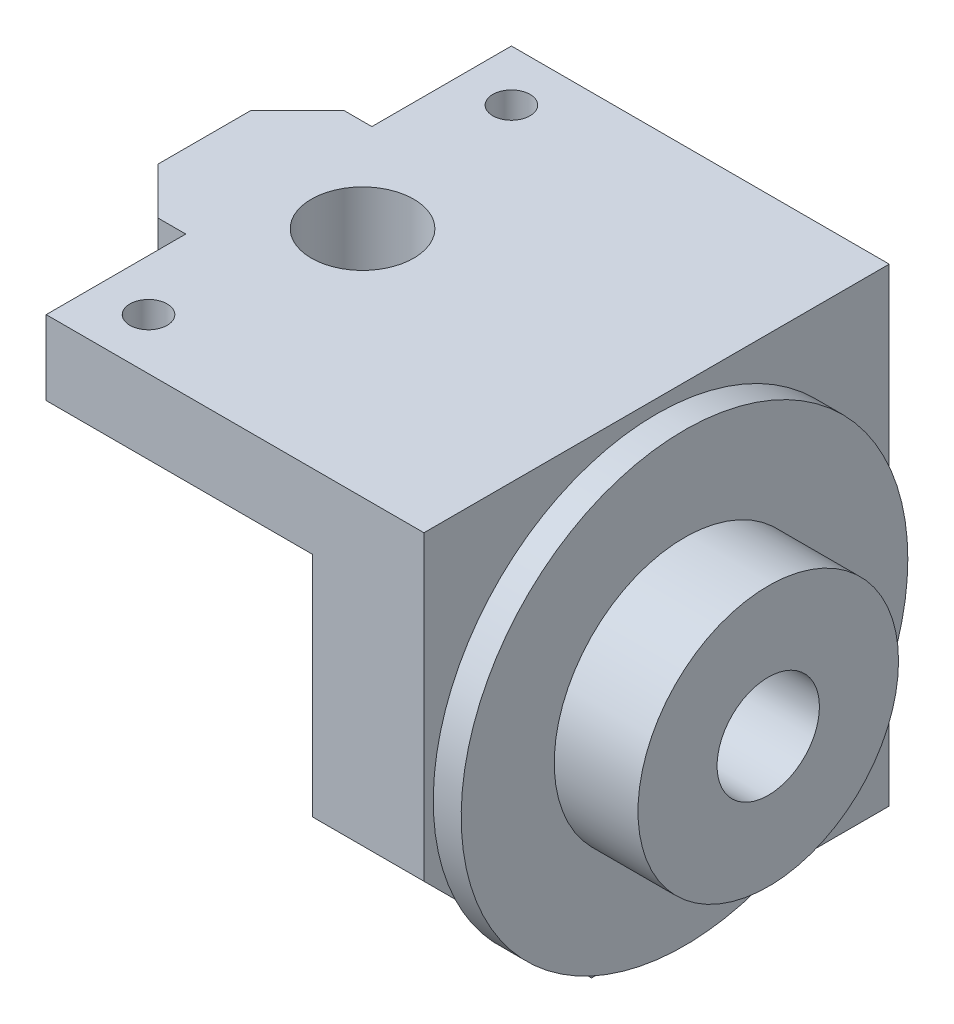
from build123d import *

# Parameters (mm, degrees)
ESQUISSE1_W             = 40.6
ESQUISSE1_H             = 50
BOSS_EXTRU_1_DEPTH      = 8
ESQUISSE2_W             = 12
ESQUISSE2_H             = 50
BOSS_EXTRU_2_DEPTH      = 42.44
CHANFREIN1_SIZE         = 18
ESQUISSE3_R             = 24
BOSS_EXTRU_3_DEPTH      = 3
ESQUISSE4_R             = 14
BOSS_EXTRU_4_DEPTH      = 9
ESQUISSE5_W             = 20
ESQUISSE5_H             = 8
BOSS_EXTRU_5_DEPTH      = 8
CHANFREIN2_SIZE         = 5
CHANFREIN3_SIZE         = 5
ESQUISSE6_R             = 5.5
ENL_V_MAT_EXTRU_1_DEPTH = 81.244733381
ESQUISSE7_R             = 5.5
ENL_V_MAT_EXTRU_2_DEPTH = 80.655939168
ESQUISSE8_R             = 2
ENL_V_MAT_EXTRU_3_DEPTH = 81.244733381


with BuildPart() as part:
    # Esquisse1 → Boss.-Extru.1 (new body)
    with BuildSketch(Plane(origin=(0, 0, 0), x_dir=(1, 0, 0), z_dir=(0, 1, 0))):
        with Locations((-26.686076334, 4.522111117)):
            Rectangle(ESQUISSE1_W, ESQUISSE1_H)
    extrude(amount=BOSS_EXTRU_1_DEPTH)

    # Esquisse2 → Boss.-Extru.2 (add)
    with BuildSketch(Plane(origin=(0, 0, 0), x_dir=(-1, 0, 0), z_dir=(0, -1, 0))):
        with Locations((12.386076334, 4.522111117)):
            Rectangle(ESQUISSE2_W, ESQUISSE2_H)
    extrude(amount=BOSS_EXTRU_2_DEPTH)

    # Chanfrein1
    chanfrein1_edges = [part.edges().sort_by_distance(p)[0] for p in [
        (-12.386076334, -42.44, 20.477888883),
    ]]
    chamfer(chanfrein1_edges, length=CHANFREIN1_SIZE)

    # Esquisse3 → Boss.-Extru.3 (add)
    with BuildSketch(Plane(origin=(-6.386076334, 0, 0), x_dir=(0, 0, -1), z_dir=(1, 0, 0))):
        with Locations(Location((4.522111117, -17.44, 0), (0, 0, 205.528779366))):
            Circle(ESQUISSE3_R)
    extrude(amount=BOSS_EXTRU_3_DEPTH)

    # Esquisse4 → Boss.-Extru.4 (add)
    with BuildSketch(Plane(origin=(-3.386076334, 0, 0), x_dir=(0, 0, -1), z_dir=(1, 0, 0))):
        with Locations((4.522111117, -17.44)):
            Circle(ESQUISSE4_R)
    extrude(amount=BOSS_EXTRU_4_DEPTH)

    # Esquisse5 → Boss.-Extru.5 (add)
    with BuildSketch(Plane.ZY.offset(46.986076334)):
        with Locations((-4.522111117, 4)):
            Rectangle(ESQUISSE5_W, ESQUISSE5_H)
    extrude(amount=BOSS_EXTRU_5_DEPTH)

    # Chanfrein2
    chanfrein2_edges = [part.edges().sort_by_distance(p)[0] for p in [
        (-54.986076334, 4, 5.477888883),
    ]]
    chamfer(chanfrein2_edges, length=CHANFREIN2_SIZE)

    # Chanfrein3
    chanfrein3_edges = [part.edges().sort_by_distance(p)[0] for p in [
        (-54.986076334, 4, -14.522111117),
    ]]
    chamfer(chanfrein3_edges, length=CHANFREIN3_SIZE)

    # Esquisse6 → Enlèv. mat.-Extru.1 (cut, through all)
    with BuildSketch(Plane(origin=(0, 8, 0), x_dir=(1, 0, 0), z_dir=(0, 1, 0))):
        with Locations(Location((-37.986076334, 4.522111117, 0), (0, 0, 270))):
            Circle(ESQUISSE6_R)
    extrude(amount=-ENL_V_MAT_EXTRU_1_DEPTH, mode=Mode.SUBTRACT)

    # Esquisse7 → Enlèv. mat.-Extru.2 (cut, through all)
    with BuildSketch(Plane(origin=(5.613923666, 0, 0), x_dir=(0, 0, -1), z_dir=(1, 0, 0))):
        with Locations((4.522111117, -17.44)):
            Circle(ESQUISSE7_R)
    extrude(amount=-ENL_V_MAT_EXTRU_2_DEPTH, mode=Mode.SUBTRACT)

    # Esquisse8 → Enlèv. mat.-Extru.3 (cut, through all)
    with BuildSketch(Plane(origin=(0, 8, 0), x_dir=(1, 0, 0), z_dir=(0, 1, 0))):
        with Locations(Location((-41.486076334, -14.977888883, 0), (0, 0, 270))):
            Circle(ESQUISSE8_R)
        with Locations(Location((-41.486076334, 24.022111117, 0), (0, 0, 270))):
            Circle(ESQUISSE8_R)
    extrude(amount=-ENL_V_MAT_EXTRU_3_DEPTH, mode=Mode.SUBTRACT)


solid = part.part
